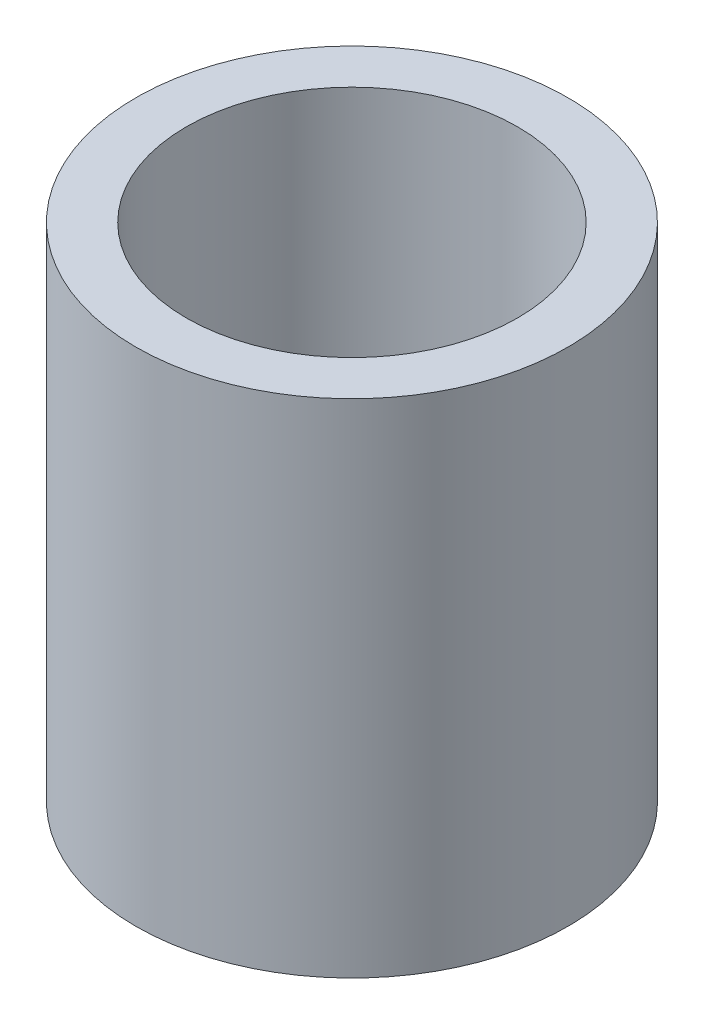
from build123d import *

# Parameters (mm, degrees)
SKETCH1_R           = 9
SKETCH1_R_2         = 6.9
BOSS_EXTRUDE1_DEPTH = 20.9


with BuildPart() as part:
    # Sketch1 → Boss-Extrude1 (new body)
    with BuildSketch(Plane(origin=(0, 0, 0), x_dir=(1, 0, 0), z_dir=(0, 1, 0))):
        with Locations(Location((0, 0, 0), (0, 0, 270))):
            Circle(SKETCH1_R)
        with Locations(Location((0, 0, 0), (0, 0, 270))):
            Circle(SKETCH1_R_2, mode=Mode.SUBTRACT)
    extrude(amount=BOSS_EXTRUDE1_DEPTH)


solid = part.part
